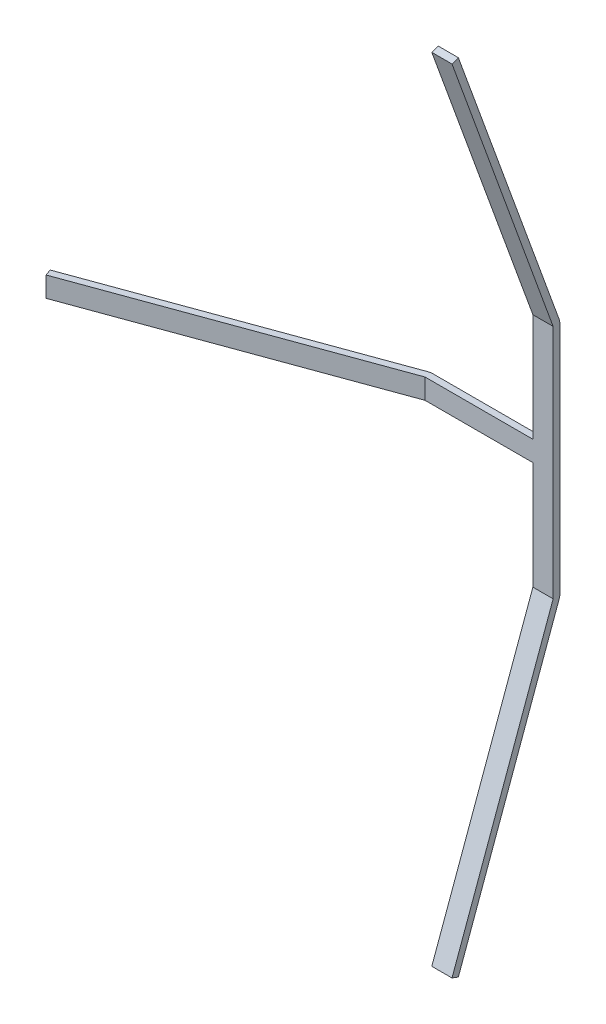
from build123d import *

# Parameters (mm, degrees)
BOSS_EXTRUDE1_DEPTH  = 350
SKETCH2_W            = 150
SKETCH2_H            = 350
BOSS_EXTRUDE2_DEPTH  = 350
BOSS_EXTRUDE3_DEPTH  = 350
BOSS_EXTRUDE4_DEPTH  = 350
SKETCH6_W            = 438.570660024
SKETCH6_H            = 30
CUT_EXTRUDE1_DEPTH   = 10
CUT_EXTRUDE2_DEPTH   = 10
SKETCH8_W            = 30
SKETCH8_H            = 438.570660025
CUT_EXTRUDE3_DEPTH   = 10
SKETCH9_W            = 30
SKETCH9_H            = 438.570660025
CUT_EXTRUDE4_DEPTH   = 10
SKETCH12_W           = 438.570660024
SKETCH12_H           = 30
BOSS_EXTRUDE5_DEPTH  = 10
BOSS_EXTRUDE6_DEPTH  = 10
SKETCH14_W           = 30
SKETCH14_H           = 438.570660025
BOSS_EXTRUDE7_DEPTH  = 10
SKETCH15_W           = 30
SKETCH15_H           = 438.570660025
BOSS_EXTRUDE8_DEPTH  = 10
BOSS_EXTRUDE10_DEPTH = 30
BOSS_EXTRUDE11_DEPTH = 30
BOSS_EXTRUDE12_DEPTH = 30
SKETCH20_W           = 438.570660024
SKETCH20_H           = 160
CUT_EXTRUDE5_DEPTH   = 1000
SKETCH21_W           = 438.570660024
SKETCH21_H           = 160
CUT_EXTRUDE6_DEPTH   = 1000
SKETCH22_W           = 160
SKETCH22_H           = 160
CUT_EXTRUDE7_DEPTH   = 1000
SKETCH23_W           = 160
SKETCH23_H           = 160
CUT_EXTRUDE8_DEPTH   = 1000
SKETCH24_W           = 160
SKETCH24_H           = 438.570660025
CUT_EXTRUDE9_DEPTH   = 1000
SKETCH25_W           = 160
SKETCH25_H           = 438.570660025
CUT_EXTRUDE10_DEPTH  = 1000
SKETCH26_W           = 160
SKETCH26_H           = 350
CUT_EXTRUDE11_DEPTH  = 1000
SKETCH27_W           = 160
SKETCH27_H           = 438.570660025
CUT_EXTRUDE12_DEPTH  = 1000
SKETCH28_W           = 160
SKETCH28_H           = 438.570660025
CUT_EXTRUDE13_DEPTH  = 1000
CUT_EXTRUDE14_DEPTH  = 1000
CUT_EXTRUDE15_DEPTH  = 1000


with BuildPart() as part:
    # Sketch1 → Boss-Extrude1 (new body)
    with BuildSketch(Plane(origin=(0, 0, 0), x_dir=(1, 0, 0), z_dir=(0, 1, 0))):
        Polygon((0, 0), (412.121612918, 0), (412.121612918, 150), align=None)
    extrude(amount=BOSS_EXTRUDE1_DEPTH)

    # Sketch2 → Boss-Extrude2 (add)
    with BuildSketch(Plane(origin=(412.121612918, 0, 0), x_dir=(0, 0, -1), z_dir=(1, 0, 0))):
        with Locations((75, 175)):
            Rectangle(SKETCH2_W, SKETCH2_H)
    extrude(amount=BOSS_EXTRUDE2_DEPTH)

    # Sketch4 → Boss-Extrude3 (add)
    with BuildSketch(Plane(origin=(762.121612918, 0, 0), x_dir=(0, 0, -1), z_dir=(1, 0, 0))):
        Polygon((0, 762.121612918), (150, 350), (0, 350), align=None)
    extrude(amount=-BOSS_EXTRUDE3_DEPTH)

    # Sketch5 → Boss-Extrude4 (add)
    with BuildSketch(Plane(origin=(762.121612918, 0, 0), x_dir=(0, 0, -1), z_dir=(1, 0, 0))):
        Polygon((0, 0), (0, -412.121612918), (150, 0), align=None)
    extrude(amount=-BOSS_EXTRUDE4_DEPTH)

    # Sketch6 → Cut-Extrude1 (cut)
    with BuildSketch(Plane(origin=(0, 0, 0), x_dir=(-0.9396926207859104, 0, 0.34202014332566316), z_dir=(-0.34202014332566316, 0, -0.9396926207859104))):
        with Locations((-219.285330012, 175)):
            Rectangle(SKETCH6_W, SKETCH6_H)
    extrude(amount=-CUT_EXTRUDE1_DEPTH, mode=Mode.SUBTRACT)

    # Sketch7 → Cut-Extrude2 (cut)
    with BuildSketch(Plane(origin=(0, 0, -150), x_dir=(-1, 0, 0), z_dir=(0, 0, -1))):
        Polygon((-412.121612918, 190), (-572.121612918, 190), (-572.121612918, 350), (-602.121612918, 350), (-602.121612918, 190), (-602.121612918, 164.900861359), (-602.121612918, 160), (-602.121612918, 0), (-572.121612918, 0), (-572.121612918, 160), (-412.121612918, 160), align=None)
    extrude(amount=-CUT_EXTRUDE2_DEPTH, mode=Mode.SUBTRACT)

    # Sketch8 → Cut-Extrude3 (cut)
    with BuildSketch(Plane(origin=(0, -48.209070726, -132.453333234), x_dir=(-1, 0, 0), z_dir=(0, -0.34202014332566283, -0.9396926207859106))):
        with Locations((-587.121612918, -167.982308514)):
            Rectangle(SKETCH8_W, SKETCH8_H)
    extrude(amount=-CUT_EXTRUDE3_DEPTH, mode=Mode.SUBTRACT)

    # Sketch9 → Cut-Extrude4 (cut)
    with BuildSketch(Plane(origin=(0, 89.151293181, -244.941164929), x_dir=(-1, 0, 0), z_dir=(0, 0.342020143325663, -0.9396926207859105))):
        with Locations((-587.121612918, 496.874725788)):
            Rectangle(SKETCH9_W, SKETCH9_H)
    extrude(amount=-CUT_EXTRUDE4_DEPTH, mode=Mode.SUBTRACT)

    # Sketch20 → Cut-Extrude5 (cut)
    with BuildSketch(Plane(origin=(0, 0, 0), x_dir=(-0.9396926207859104, 0, 0.34202014332566316), z_dir=(-0.34202014332566316, 0, -0.9396926207859104))):
        with Locations((-219.285330012, 80)):
            Rectangle(SKETCH20_W, SKETCH20_H)
    extrude(amount=-CUT_EXTRUDE5_DEPTH, mode=Mode.SUBTRACT)

    # Sketch21 → Cut-Extrude6 (cut)
    with BuildSketch(Plane(origin=(0, 0, 0), x_dir=(-0.9396926207859104, 0, 0.34202014332566316), z_dir=(-0.34202014332566316, 0, -0.9396926207859104))):
        with Locations((-219.285330012, 270)):
            Rectangle(SKETCH21_W, SKETCH21_H)
    extrude(amount=-CUT_EXTRUDE6_DEPTH, mode=Mode.SUBTRACT)

    # Sketch22 → Cut-Extrude7 (cut)
    with BuildSketch(Plane(origin=(0, 0, -150), x_dir=(-1, 0, 0), z_dir=(0, 0, -1))):
        with Locations((-492.121612918, 270)):
            Rectangle(SKETCH22_W, SKETCH22_H)
    extrude(amount=-CUT_EXTRUDE7_DEPTH, mode=Mode.SUBTRACT)

    # Sketch23 → Cut-Extrude8 (cut)
    with BuildSketch(Plane(origin=(0, 0, -150), x_dir=(-1, 0, 0), z_dir=(0, 0, -1))):
        with Locations((-492.121612918, 80)):
            Rectangle(SKETCH23_W, SKETCH23_H)
    extrude(amount=-CUT_EXTRUDE8_DEPTH, mode=Mode.SUBTRACT)

    # Sketch24 → Cut-Extrude9 (cut)
    with BuildSketch(Plane(origin=(0, -48.209070726, -132.453333234), x_dir=(-1, 0, 0), z_dir=(0, -0.34202014332566283, -0.9396926207859106))):
        with Locations((-492.121612918, -167.982308514)):
            Rectangle(SKETCH24_W, SKETCH24_H)
    extrude(amount=-CUT_EXTRUDE9_DEPTH, mode=Mode.SUBTRACT)

    # Sketch25 → Cut-Extrude10 (cut)
    with BuildSketch(Plane(origin=(0, -48.209070726, -132.453333234), x_dir=(-1, 0, 0), z_dir=(0, -0.34202014332566283, -0.9396926207859106))):
        with Locations((-682.121612918, -167.982308514)):
            Rectangle(SKETCH25_W, SKETCH25_H)
    extrude(amount=-CUT_EXTRUDE10_DEPTH, mode=Mode.SUBTRACT)

    # Sketch26 → Cut-Extrude11 (cut)
    with BuildSketch(Plane(origin=(0, 0, -150), x_dir=(-1, 0, 0), z_dir=(0, 0, -1))):
        with Locations((-682.121612918, 175)):
            Rectangle(SKETCH26_W, SKETCH26_H)
    extrude(amount=-CUT_EXTRUDE11_DEPTH, mode=Mode.SUBTRACT)

    # Sketch27 → Cut-Extrude12 (cut)
    with BuildSketch(Plane(origin=(0, 89.151293181, -244.941164929), x_dir=(-1, 0, 0), z_dir=(0, 0.342020143325663, -0.9396926207859105))):
        with Locations((-682.121612918, 496.874725788)):
            Rectangle(SKETCH27_W, SKETCH27_H)
    extrude(amount=-CUT_EXTRUDE12_DEPTH, mode=Mode.SUBTRACT)

    # Sketch28 → Cut-Extrude13 (cut)
    with BuildSketch(Plane(origin=(0, 89.151293181, -244.941164929), x_dir=(-1, 0, 0), z_dir=(0, 0.342020143325663, -0.9396926207859105))):
        with Locations((-492.121612918, 496.874725788)):
            Rectangle(SKETCH28_W, SKETCH28_H)
    extrude(amount=-CUT_EXTRUDE13_DEPTH, mode=Mode.SUBTRACT)

    # Sketch29 → Cut-Extrude14 (cut)
    with BuildSketch(Plane.XZ.offset(-160)):
        Polygon((572.121612918, 0), (29.238044002, 0), (413.884882725, -140), (572.121612918, -140), align=None)
    extrude(amount=-CUT_EXTRUDE14_DEPTH, mode=Mode.SUBTRACT)

    # Sketch30 → Cut-Extrude15 (cut)
    with BuildSketch(Plane.ZY.offset(-572.121612918)):
        Polygon((-140, 348.236730193), (-140, 1.763269807), (0, -382.883568917), (0, 732.883568917), align=None)
    extrude(amount=-CUT_EXTRUDE15_DEPTH, mode=Mode.SUBTRACT)


with BuildPart() as body_2:
    # Sketch12 → Boss-Extrude5 (new body)
    with BuildSketch(Plane(origin=(0, 0, 0), x_dir=(-0.9396926207859104, 0, 0.34202014332566316), z_dir=(-0.34202014332566316, 0, -0.9396926207859104))):
        with Locations((-219.285330012, 175)):
            Rectangle(SKETCH12_W, SKETCH12_H)
    extrude(amount=BOSS_EXTRUDE5_DEPTH)



with BuildPart() as body_3:
    # Sketch13 → Boss-Extrude6 (new body)
    with BuildSketch(Plane(origin=(0, 0, -150), x_dir=(-1, 0, 0), z_dir=(0, 0, -1))):
        Polygon((-572.121612918, 0), (-572.121612918, 160), (-412.121612918, 160), (-412.121612918, 190), (-572.121612918, 190), (-572.121612918, 350), (-602.121612918, 350), (-602.121612918, 0), align=None)
    extrude(amount=BOSS_EXTRUDE6_DEPTH)



with BuildPart() as body_4:
    # Sketch14 → Boss-Extrude7 (new body)
    with BuildSketch(Plane(origin=(0, -48.209070726, -132.453333234), x_dir=(-1, 0, 0), z_dir=(0, -0.34202014332566283, -0.9396926207859106))):
        with Locations((-587.121612918, -167.982308514)):
            Rectangle(SKETCH14_W, SKETCH14_H)
    extrude(amount=BOSS_EXTRUDE7_DEPTH)



with BuildPart() as body_5:
    # Sketch15 → Boss-Extrude8 (new body)
    with BuildSketch(Plane(origin=(0, 89.151293181, -244.941164929), x_dir=(-1, 0, 0), z_dir=(0, 0.342020143325663, -0.9396926207859105))):
        with Locations((-587.121612918, 496.874725788)):
            Rectangle(SKETCH15_W, SKETCH15_H)
    extrude(amount=BOSS_EXTRUDE8_DEPTH)


with BuildPart() as body_3_1:
    add(body_3.part)

    add(body_5.part)  # Boss-Extrude10 merges body 5
    # Sketch17 → Boss-Extrude10 (add)
    with BuildSketch(Plane(origin=(602.121612918, 0, 0), x_dir=(0, 0, -1), z_dir=(1, 0, 0))):
        Polygon((160, 350), (159.396926208, 353.420201433), (150, 350), align=None)
    extrude(amount=-BOSS_EXTRUDE10_DEPTH)


with BuildPart() as body_4_1:
    add(body_4.part)

    add(body_3_1.part)  # Boss-Extrude11 merges body 3
    # Sketch18 → Boss-Extrude11 (add)
    with BuildSketch(Plane(origin=(602.121612918, 0, 0), x_dir=(0, 0, -1), z_dir=(1, 0, 0))):
        Polygon((159.396926208, -3.420201433), (150, 0), (160, 0), align=None)
    extrude(amount=-BOSS_EXTRUDE11_DEPTH)


with BuildPart() as body_2_1:
    add(body_2.part)

    add(body_4_1.part)  # Boss-Extrude12 merges body 4
    # Sketch19 → Boss-Extrude12 (add)
    with BuildSketch(Plane.XZ.offset(-160)):
        Polygon((408.701411485, -159.396926208), (412.121612918, -150), (412.121612918, -160), align=None)
    extrude(amount=-BOSS_EXTRUDE12_DEPTH)


solid = body_2_1.part
